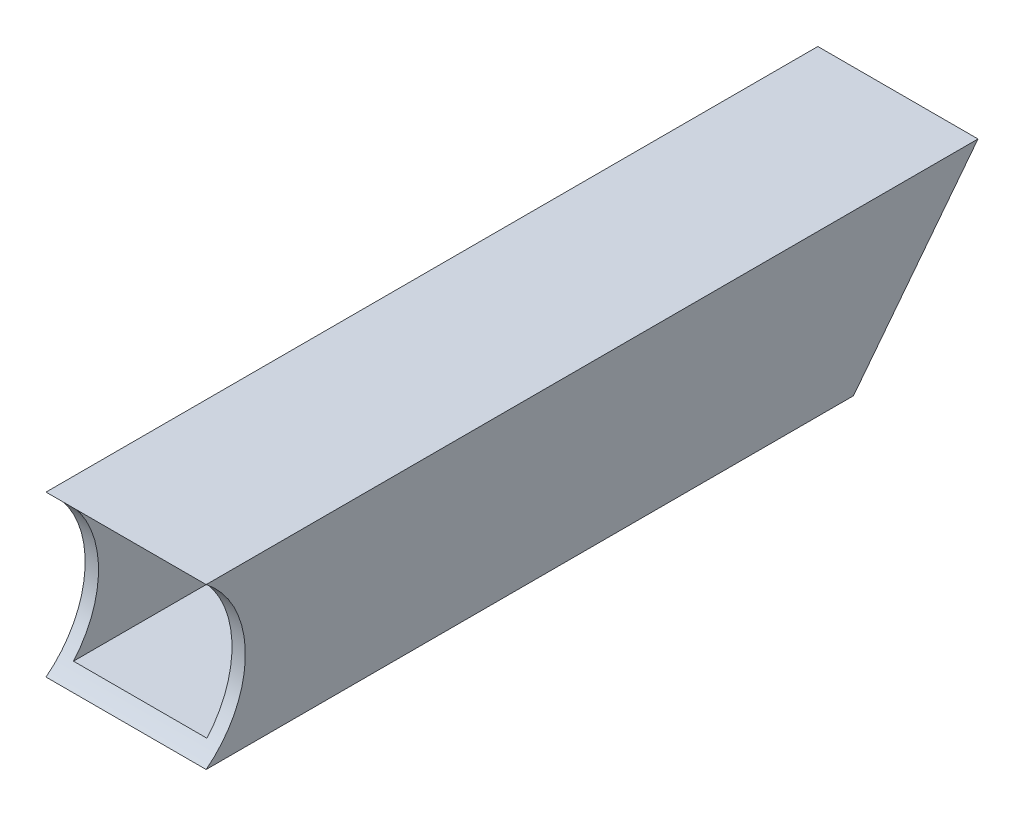
from build123d import *

# Parameters (mm, degrees)
BOSS_EXTRUDE1_DEPTH = 38.1
SKETCH2_W           = 31.75
SKETCH2_H           = 31.75
CUT_EXTRUDE1_DEPTH  = 206.593204132


with BuildPart() as part:
    # Sketch1 → Boss-Extrude1 (new body)
    with BuildSketch(Plane(origin=(0, 0, 0), x_dir=(0, 0, -1), z_dir=(1, 0, 0))):
        with BuildLine():
            Line((168.785784374, 0), (198.40702, 38.1))
            Line((198.40702, 38.1), (14.810617813, 38.1))
            ThreePointArc((14.810617813, 38.1), (21.675298243, 29.653694926), (24.13, 19.05))
            ThreePointArc((24.13, 19.05), (21.675298243, 8.446305074), (14.810617813, 0))
            Line((14.810617813, 0), (168.785784374, 0))
        make_face()
    extrude(amount=BOSS_EXTRUDE1_DEPTH)

    # Sketch2 → Cut-Extrude1 (cut, through all)
    with BuildSketch(Plane.XY):
        with Locations((19.05, 19.05)):
            Rectangle(SKETCH2_W, SKETCH2_H)
    extrude(amount=-CUT_EXTRUDE1_DEPTH, mode=Mode.SUBTRACT)


solid = part.part
